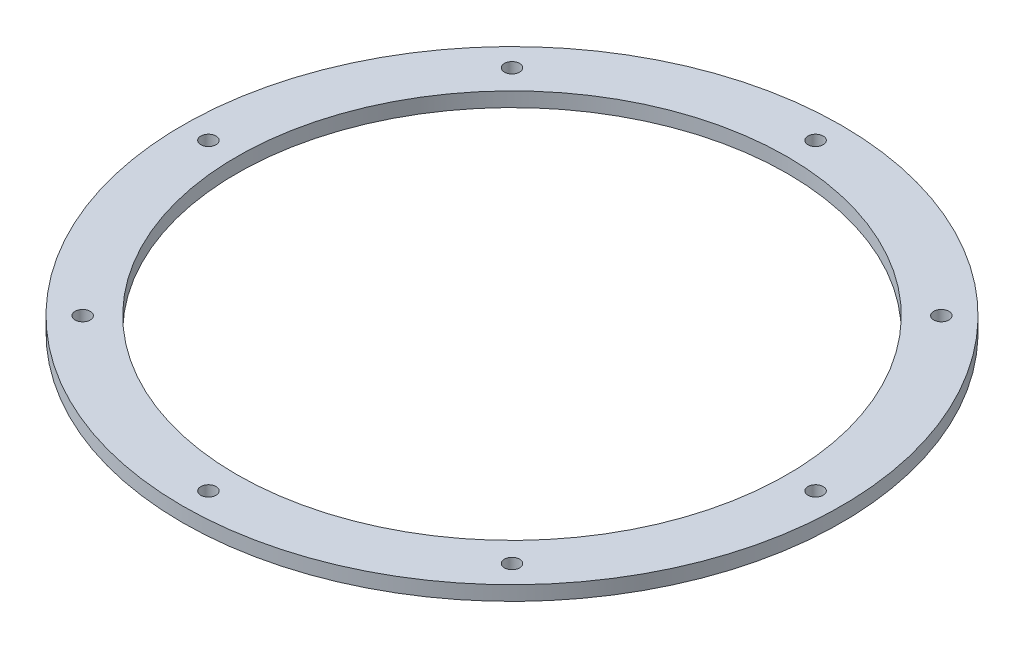
from build123d import *

# Parameters (mm, degrees)
SKETCH_1_W          = 15
SKETCH_1_H          = 4
SKETCH_2_R          = 2.1
CUT_EXTRUDE_1_DEPTH = 10


with BuildPart() as part:
    # 草图1 → 旋转1 (revolve)
    with BuildSketch(Plane.XY, mode=Mode.PRIVATE) as revolve_1_sk:
        with Locations((83.58, 17.904981343)):
            Rectangle(SKETCH_1_W, SKETCH_1_H)
    revolve(revolve_1_sk.sketch.rotate(Axis((0, 0, 0), (0, 1, 0)), 90), axis=Axis((0, 0, 0), (0, 1, 0)))

    # 草图2 → 切除-拉伸1 (cut)
    with BuildSketch(Plane(origin=(0, 19.904981343, 0), x_dir=(1, 0, 0), z_dir=(0, 1, 0))):
        with Locations(Location((-83.9, 0, 0), (0, 0, 270))):
            Circle(SKETCH_2_R)
        with Locations(Location((-59.326258942, 59.326258942, 0), (0, 0, 270))):
            Circle(SKETCH_2_R)
        with Locations(Location((0, 83.9, 0), (0, 0, 270))):
            Circle(SKETCH_2_R)
        with Locations(Location((59.326258942, 59.326258942, 0), (0, 0, 270))):
            Circle(SKETCH_2_R)
        with Locations(Location((83.9, 0, 0), (0, 0, 270))):
            Circle(SKETCH_2_R)
        with Locations(Location((59.326258942, -59.326258942, 0), (0, 0, 270))):
            Circle(SKETCH_2_R)
        with Locations(Location((0, -83.9, 0), (0, 0, 270))):
            Circle(SKETCH_2_R)
        with Locations(Location((-59.326258942, -59.326258942, 0), (0, 0, 270))):
            Circle(SKETCH_2_R)
    extrude(amount=-CUT_EXTRUDE_1_DEPTH, mode=Mode.SUBTRACT)


solid = part.part
